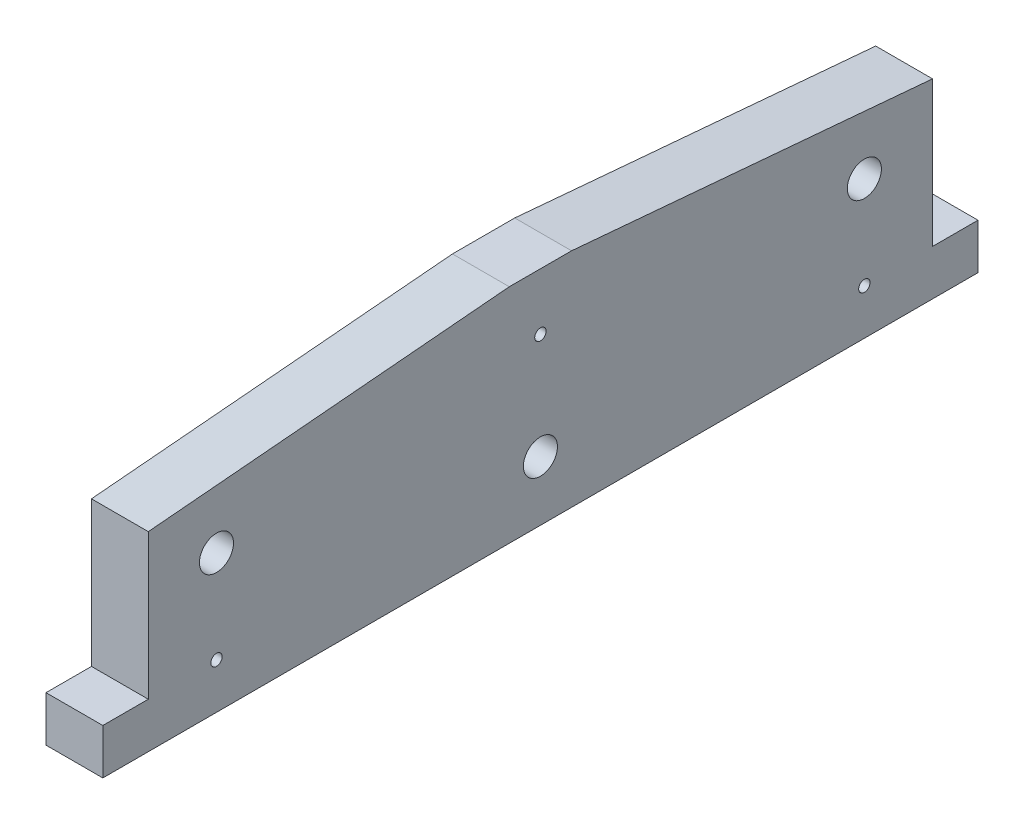
from build123d import *

# Parameters (mm, degrees)
RESSALTO_EXTRUS_O2_DEPTH = 10
ESBO_O3_R                = 1
ESBO_O3_R_2              = 3
CORTE_EXTRUS_O1_DEPTH    = 87.670292346


with BuildPart() as part:
    # Esboço2 → Ressalto-extrusão2 (new body)
    with BuildSketch(Plane(origin=(0, 0, 0), x_dir=(0, 0, -1), z_dir=(1, 0, 0))):
        Polygon((69.5, -29.489859634), (77.5, -29.489859634), (77.5, -37.489859634), (-76.5, -37.489859634), (-76.5, -29.489859634), (-68.5, -29.489859634), (-68.5, -3.948025217), (-4.978169529, 1.609414836), (0, 1.609414836), (5.978169529, 1.609414836), (69.5, -3.948025217), align=None)
    extrude(amount=RESSALTO_EXTRUS_O2_DEPTH)

    # Esboço3 → Corte-extrusão1 (cut, through all)
    with BuildSketch(Plane(origin=(10, 0, 0), x_dir=(0, 0, -1), z_dir=(1, 0, 0))):
        with Locations((0.5, -8.390585169)):
            Circle(ESBO_O3_R)
        with Locations((0.5, -27.002843355)):
            Circle(ESBO_O3_R_2)
        with Locations((57.5, -13.178770401)):
            Circle(ESBO_O3_R_2)
        with Locations((57.5, -29.489859634)):
            Circle(ESBO_O3_R)
        with Locations((-56.5, -13.178770401)):
            Circle(ESBO_O3_R_2)
        with Locations((-56.5, -29.489859634)):
            Circle(ESBO_O3_R)
    extrude(amount=-CORTE_EXTRUS_O1_DEPTH, mode=Mode.SUBTRACT)


solid = part.part
